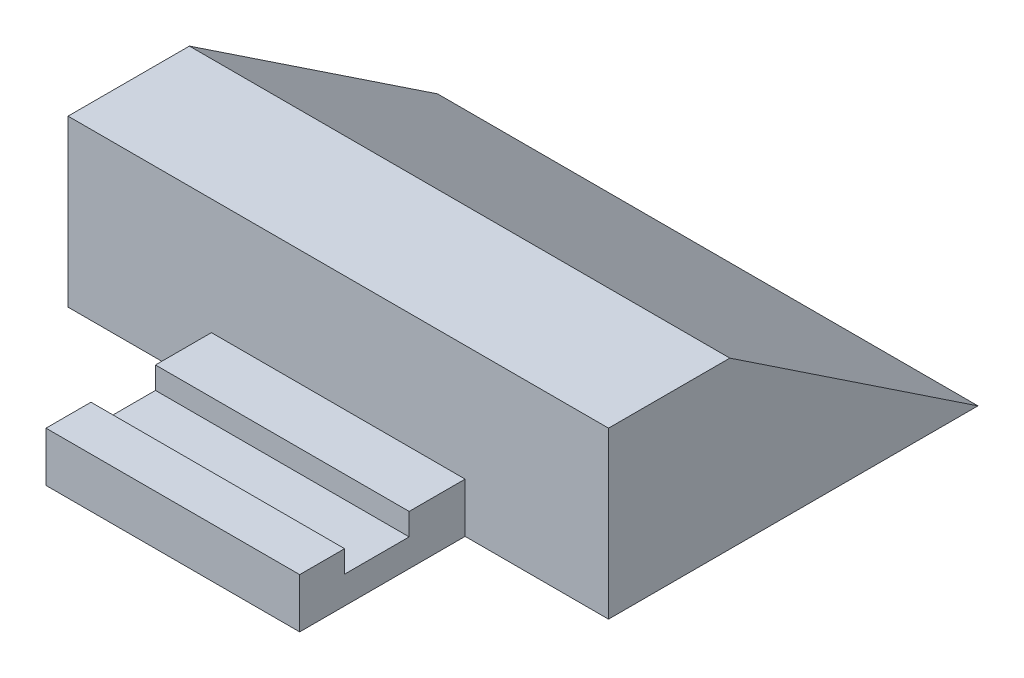
from build123d import *

# Parameters (mm, degrees)
EXTRUDE_1_DEPTH     = 30
CUT_EXTRUDE_1_DEPTH = 98
SKETCH_3_W          = 46
SKETCH_3_H          = 11.7
CUT_EXTRUDE_2_DEPTH = 25
SKETCH_4_W          = 33.079477917
SKETCH_4_H          = 22.974752345
CUT_EXTRUDE_3_DEPTH = 46


with BuildPart() as part:
    # Эскиз1 → Бобышка-Вытянуть1 (new body)
    with BuildSketch(Plane(origin=(0, 0, 0), x_dir=(1, 0, 0), z_dir=(0, 1, 0))):
        Polygon((-49, 100), (49, 100), (49, 32), (23, 32), (23, 2), (-23, 2), (-23, 32), (-49, 32), align=None)
    extrude(amount=EXTRUDE_1_DEPTH)

    # Эскиз2 → Вырез-Вытянуть1 (cut)
    with BuildSketch(Plane.ZY.offset(49)):
        Polygon((-99, 0), (-54, 30), (-54, 44.902794758), (-113.255457038, 44.902794758), (-113.255457038, 0), align=None)
    extrude(amount=-CUT_EXTRUDE_1_DEPTH, mode=Mode.SUBTRACT)

    # Эскиз3 → Вырез-Вытянуть2 (cut)
    with BuildSketch(Plane(origin=(0, 30, 0), x_dir=(1, 0, 0), z_dir=(0, 1, 0))):
        with Locations((0, 16)):
            Rectangle(SKETCH_3_W, SKETCH_3_H)
    extrude(amount=-CUT_EXTRUDE_2_DEPTH, mode=Mode.SUBTRACT)

    # Эскиз4 → Вырез-Вытянуть3 (cut)
    with BuildSketch(Plane.ZY.offset(23)):
        with Locations((-15.460261042, 20.487376172)):
            Rectangle(SKETCH_4_W, SKETCH_4_H)
    extrude(amount=-CUT_EXTRUDE_3_DEPTH, mode=Mode.SUBTRACT)


solid = part.part
